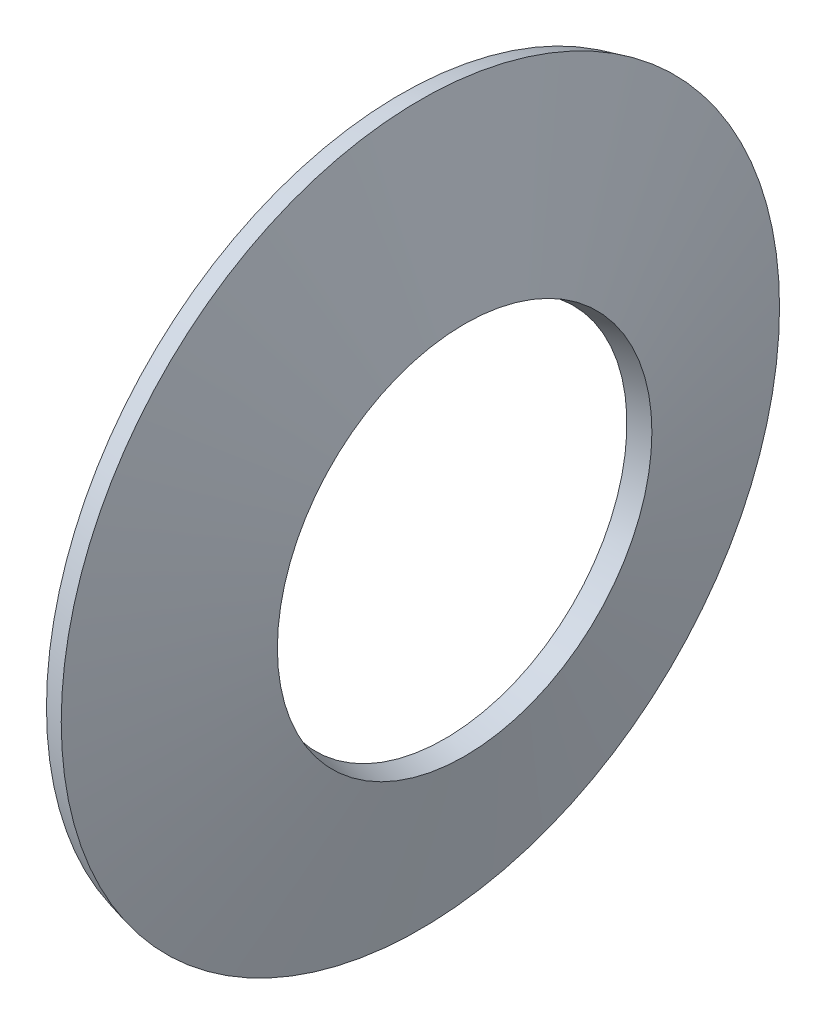
from build123d import *


with BuildPart() as part:
    # Esquisse2 → Base-Révolution (revolve)
    with BuildSketch(Plane.XY):
        Polygon((1.725269231, 7.1), (2.5, 7.299479912), (0.774730769, 14), (0, 13.800520088), align=None)
    revolve(axis=Axis((0, 0, 0), (1, 0, 0)))


solid = part.part
